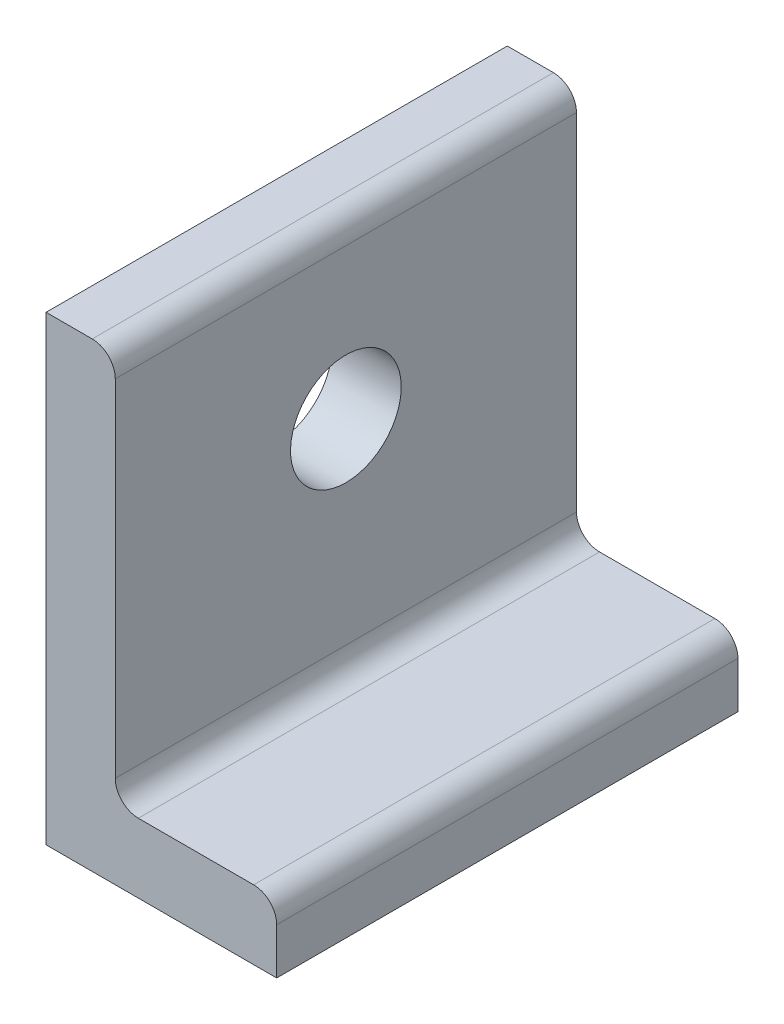
from build123d import *

# Parameters (mm, degrees)
EXTRUDE_1_DEPTH     = 20
SKETCH_2_R          = 2.4
CUT_EXTRUDE_1_DEPTH = 15
FILLET_1_R          = 1


with BuildPart() as part:
    # 草图1 → 凸台-拉伸1 (new body)
    with BuildSketch(Plane.XY):
        Polygon((0, 20), (0, 0), (10, 0), (10, 3), (3, 3), (3, 20), align=None)
    extrude(amount=EXTRUDE_1_DEPTH)

    # 草图2 → 切除-拉伸1 (cut)
    with BuildSketch(Plane.ZY):
        with Locations(Location((10, 12.5, 0), (0, 0, 270))):
            Circle(SKETCH_2_R)
    extrude(amount=-CUT_EXTRUDE_1_DEPTH, mode=Mode.SUBTRACT)

    # 圆角1
    fillet_1_edges = [part.edges().sort_by_distance(p)[0] for p in [
        (3, 20, 10),
        (3, 3, 10),
        (10, 3, 10),
    ]]
    fillet(fillet_1_edges, radius=FILLET_1_R)


solid = part.part
